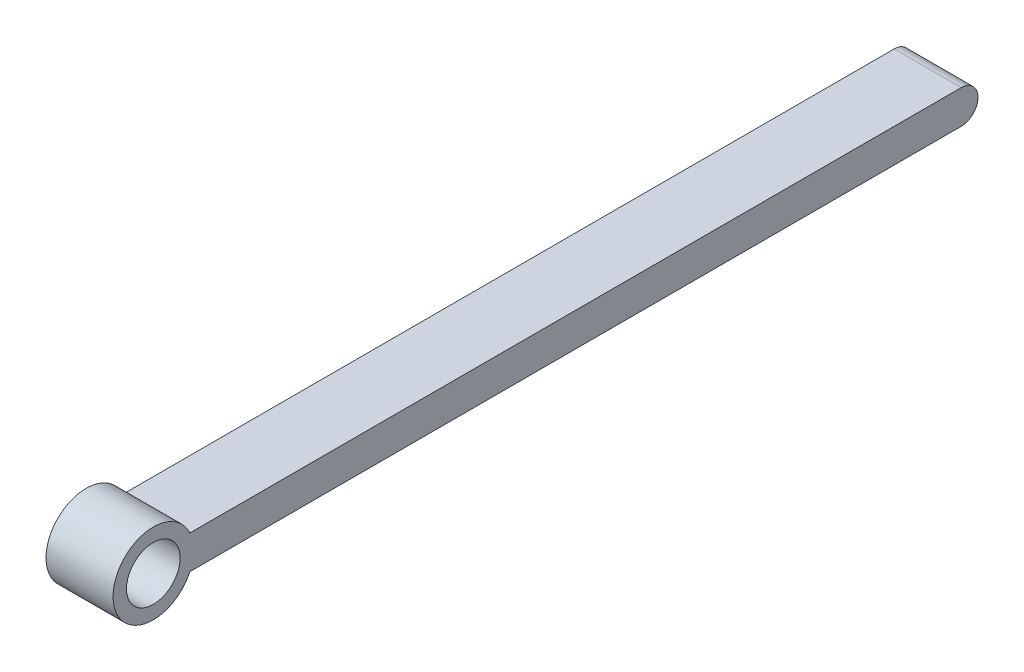
from build123d import *

# Parameters (mm, degrees)
SKETCH1_R           = 4
BOSS_EXTRUDE1_DEPTH = 10


with BuildPart() as part:
    # Sketch1 → Boss-Extrude1 (new body)
    with BuildSketch(Plane(origin=(0, 0, 0), x_dir=(0, 0, -1), z_dir=(1, 0, 0))):
        with BuildLine():
            ThreePointArc((25.027203864, 20.624541707), (13.572847807, 18.124541707), (25.027203864, 15.624541707))
            Line((25.027203864, 15.624541707), (140.072847807, 15.624541707))
            ThreePointArc((140.072847807, 15.624541707), (142.572847807, 18.124541707), (140.072847807, 20.624541707))
            Line((140.072847807, 20.624541707), (25.027203864, 20.624541707))
        make_face()
        with Locations((19.572847807, 18.124541707)):
            Circle(SKETCH1_R, mode=Mode.SUBTRACT)
    extrude(amount=BOSS_EXTRUDE1_DEPTH)


solid = part.part
